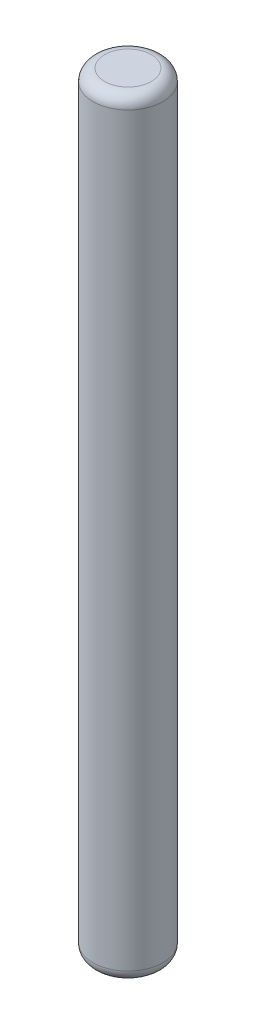
from build123d import *

# Parameters (mm, degrees)
ESQUISSE1_R        = 0.75
BOSS_EXTRU_1_DEPTH = 16.5
CONG_1_R           = 0.25


with BuildPart() as part:
    # Esquisse1 → Boss.-Extru.1 (new body)
    with BuildSketch(Plane(origin=(0, 0, 0), x_dir=(1, 0, 0), z_dir=(0, 1, 0))):
        with Locations(Location((0, 0, 0), (0, 0, 270))):
            Circle(ESQUISSE1_R)
    extrude(amount=BOSS_EXTRU_1_DEPTH)

    # Congé1
    cong_1_edges = [part.edges().sort_by_distance(p)[0] for p in [
        (0, 0, -0.75),
        (0, 16.5, -0.75),
    ]]
    fillet(cong_1_edges, radius=CONG_1_R)


solid = part.part
